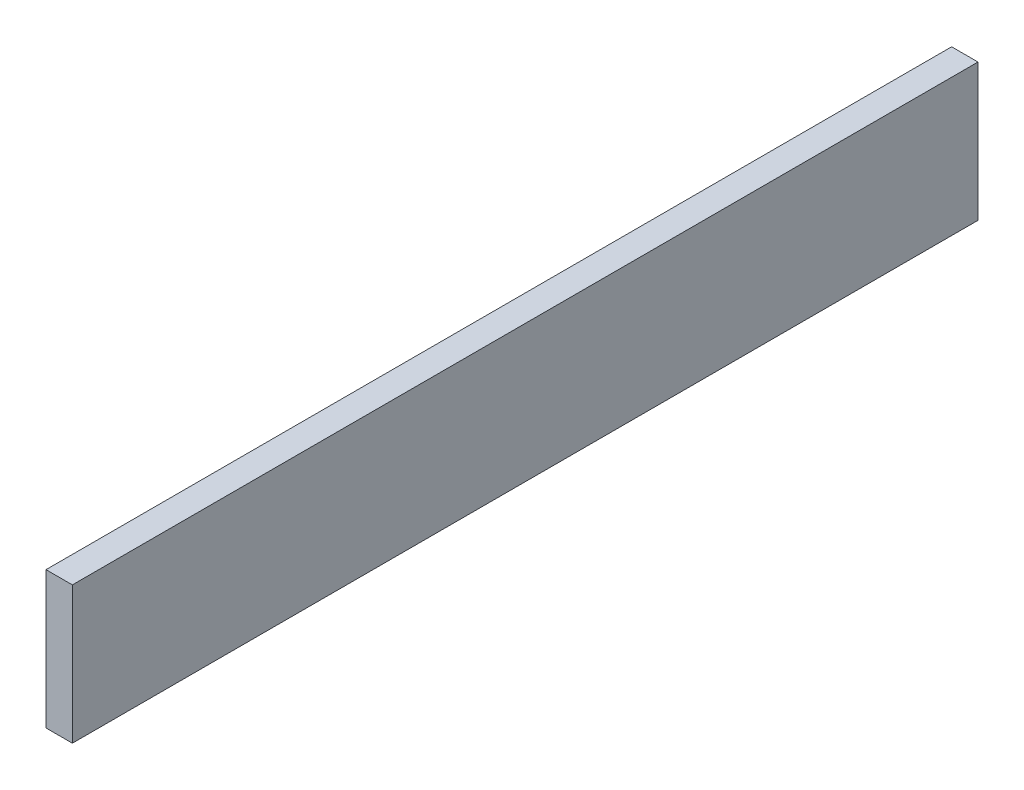
from build123d import *

# Parameters (mm, degrees)
BOSS_EXTRUDE1_START = 50
SKETCH1_W           = 16.9195
SKETCH1_H           = 57.785
SKETCH1_W_2         = 9.0805
BOSS_EXTRUDE1_DEPTH = 5


with BuildPart() as part:
    # Sketch1 → Boss-Extrude1 (new body)
    with BuildSketch(Plane.YZ.offset(BOSS_EXTRUDE1_START)):
        Polygon((-774.1, 3048.381), (-774.1, 3162.3), (-800.1, 3162.3), (-800.1, 3048.381), (-791.0195, 3048.381), align=None)
        with Locations((-782.55975, 3019.4885)):
            Rectangle(SKETCH1_W, SKETCH1_H)
        with Locations((-795.55975, 3019.4885)):
            Rectangle(SKETCH1_W_2, SKETCH1_H)
    extrude(amount=BOSS_EXTRUDE1_DEPTH)


solid = part.part
